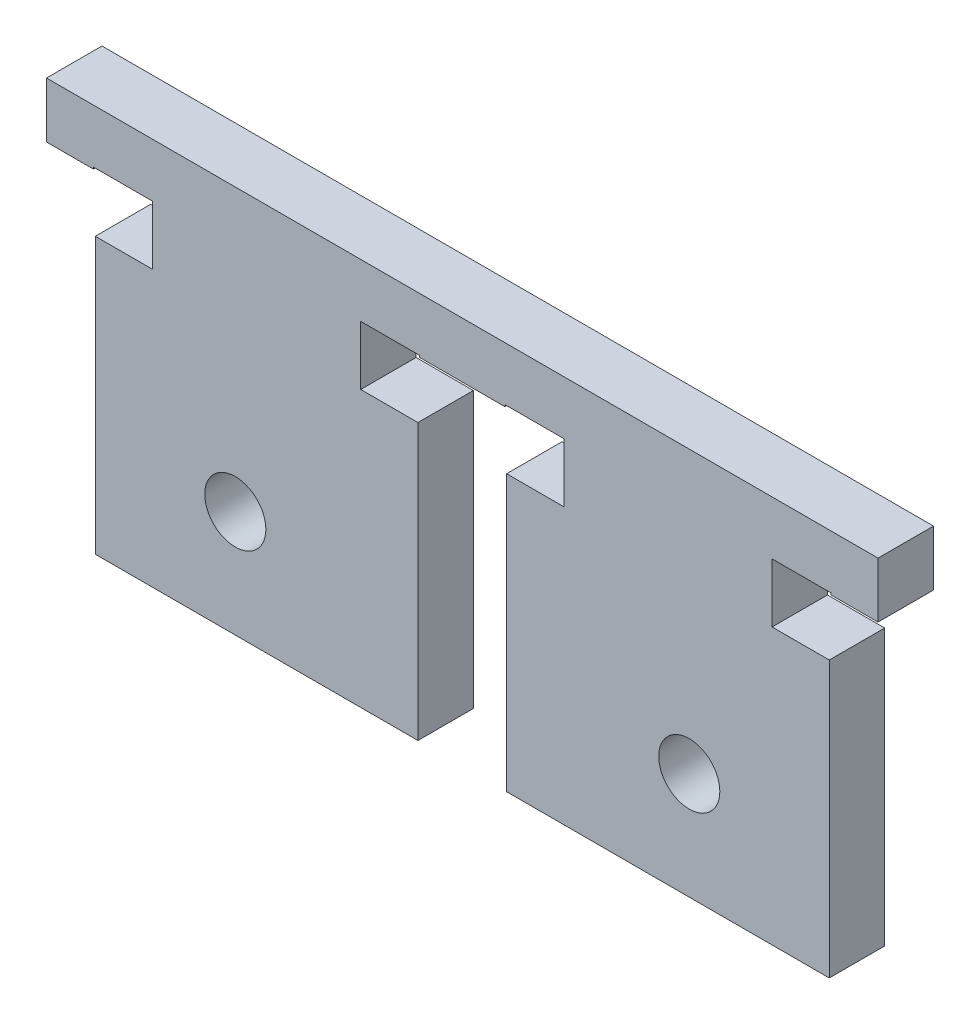
from build123d import *

# Parameters (mm, degrees)
SKETCH3_W            = 95.25
SKETCH3_H            = 60.96
BOSS_EXTRUDE1_DEPTH  = 6.35
SKETCH4_W            = 5.588
SKETCH4_H            = 45.72
SKETCH4_W_2          = 10.16
CUT_EXTRUDE1_DEPTH   = 6.35
SKETCH5_W            = 6.7564
SKETCH5_H            = 6.7564
CUT_EXTRUDE2_DEPTH   = 57.898976485
SKETCH9_W            = 95.25
SKETCH9_H            = 6.35
CUT_EXTRUDE6_DEPTH   = 8.89
SKETCH11_W           = 84.074
SKETCH11_H           = 6.35
CUT_EXTRUDE9_DEPTH   = 7.62
M6_CLEARANCE_HOLE2_D = 7


with BuildPart() as part:
    # Sketch3 → Boss-Extrude1 (new body)
    with BuildSketch(Plane.XY):
        Rectangle(SKETCH3_W, SKETCH3_H)
    extrude(amount=BOSS_EXTRUDE1_DEPTH)

    # Sketch4 → Cut-Extrude1 (cut)
    with BuildSketch(Plane.XY.offset(6.35)):
        with Locations((-44.831, -7.62)):
            Rectangle(SKETCH4_W, SKETCH4_H)
        with Locations((0, -7.62)):
            Rectangle(SKETCH4_W_2, SKETCH4_H)
        with Locations((44.831, -7.62)):
            Rectangle(SKETCH4_W, SKETCH4_H)
    extrude(amount=-CUT_EXTRUDE1_DEPTH, mode=Mode.SUBTRACT)

    # Sketch5 → Cut-Extrude2 (cut, through all)
    with BuildSketch(Plane.XY.offset(6.35)):
        with Locations((-38.862, 12.065)):
            Rectangle(SKETCH5_W, SKETCH5_H)
        with Locations((-8.255, 12.065)):
            Rectangle(SKETCH5_W, SKETCH5_H)
    cut_extrude2 = extrude(amount=-CUT_EXTRUDE2_DEPTH, mode=Mode.SUBTRACT)

    # Mirror1: Cut-Extrude2 across plane
    add(cut_extrude2.mirror(Plane(origin=(0, 0, 0), x_dir=(0, 0, 1), z_dir=(1, 0, 0))), mode=Mode.SUBTRACT)

    # Sketch9 → Cut-Extrude6 (cut)
    with BuildSketch(Plane(origin=(0, 30.48, 0), x_dir=(1, 0, 0), z_dir=(0, 1, 0))):
        with Locations((0, -3.175)):
            Rectangle(SKETCH9_W, SKETCH9_H)
    extrude(amount=-CUT_EXTRUDE6_DEPTH, mode=Mode.SUBTRACT)

    # Sketch11 → Cut-Extrude9 (cut)
    with BuildSketch(Plane.XZ.offset(30.48)):
        with Locations((0, 3.175)):
            Rectangle(SKETCH11_W, SKETCH11_H)
    extrude(amount=-CUT_EXTRUDE9_DEPTH, mode=Mode.SUBTRACT)

    # M6 Clearance Hole2 (through all)
    with Locations(Plane.XY.offset(6.35)):
        with Locations((26, -10.6279), (-26, -10.6279)):
            Hole(M6_CLEARANCE_HOLE2_D / 2)


solid = part.part
